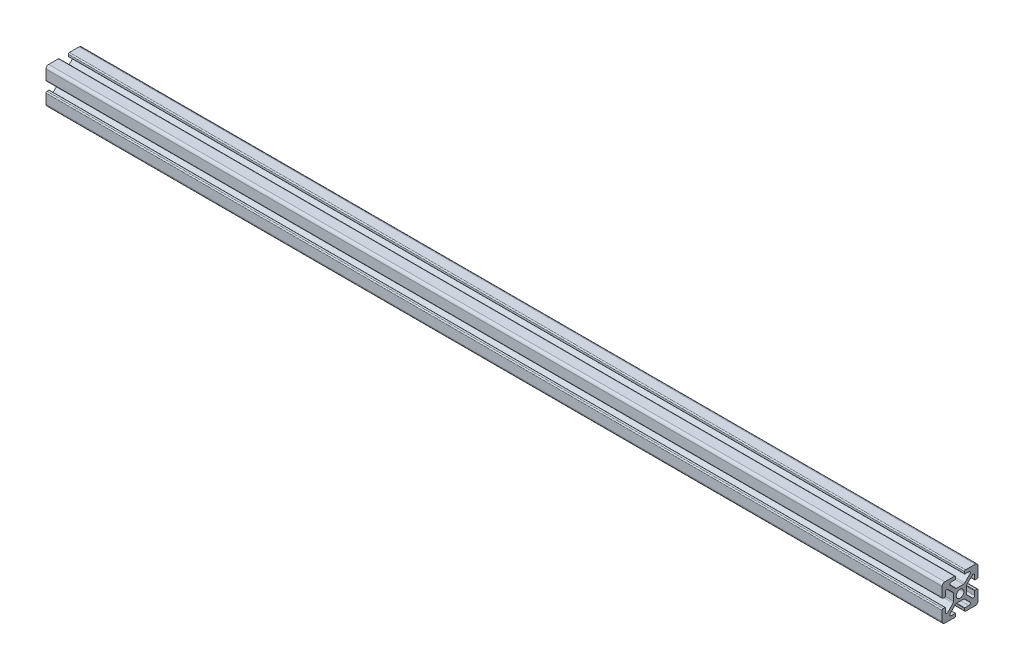
from build123d import *
from build123d.topology import SkipClean

# Parameters (mm, degrees)
BOSS_EXTRUDE1_DEPTH      = 152.4
BOSS_EXTRUDE1_DEPTH_BACK = 152.4
SKETCH4_R                = 2.15
BOSS_EXTRUDE2_DEPTH      = 195.2


with BuildPart() as part:
    # Sketch3 → Boss-Extrude1 (new, two sides: drawn at the far end of the back side and taken through both)
    with BuildSketch(Plane(origin=(0, 0, 0), x_dir=(0, 0, -1), z_dir=(1, 0, 0)).offset(-BOSS_EXTRUDE1_DEPTH_BACK)):
        with BuildLine():
            Line((-5.515685425, 6.807463915), (-2.601114729, 3.892893219))
            ThreePointArc((-2.601114729, 3.892893219), (-2.27669138, 3.676120467), (-1.894007948, 3.6))
            Line((-1.894007948, 3.6), (0, 3.6))
            Line((0, 3.6), (0, 2.15))
            ThreePointArc((0, 2.15), (-1.52027958, 1.52027958), (-2.15, 0))
            Line((-2.15, 0), (-3.6, 0))
            Line((-3.6, 0), (-3.6, 1.894007948))
            ThreePointArc((-3.6, 1.894007948), (-3.676120467, 2.27669138), (-3.892893219, 2.601114729))
            Line((-3.892893219, 2.601114729), (-6.807463915, 5.515685425))
            ThreePointArc((-6.807463915, 5.515685425), (-7.679296086, 5.689103626), (-8.17314934, 4.95))
            Line((-8.17314934, 4.95), (-8.17314934, 2.7))
            ThreePointArc((-8.17314934, 2.7), (-8.231727984, 2.558578644), (-8.37314934, 2.5))
            Line((-8.37314934, 2.5), (-9.4, 2.5))
            ThreePointArc((-9.4, 2.5), (-9.824264069, 2.675735931), (-10, 3.1))
            Line((-10, 3.1), (-10, 8.5))
            ThreePointArc((-10, 8.5), (-9.560660172, 9.560660172), (-8.5, 10))
            Line((-8.5, 10), (-3.1, 10))
            ThreePointArc((-3.1, 10), (-2.675735931, 9.824264069), (-2.5, 9.4))
            Line((-2.5, 9.4), (-2.5, 8.37314934))
            ThreePointArc((-2.5, 8.37314934), (-2.558578644, 8.231727984), (-2.7, 8.17314934))
            Line((-2.7, 8.17314934), (-4.95, 8.17314934))
            ThreePointArc((-4.95, 8.17314934), (-5.689103626, 7.679296086), (-5.515685425, 6.807463915))
        make_face()
    extrude(amount=BOSS_EXTRUDE1_DEPTH + BOSS_EXTRUDE1_DEPTH_BACK)

    # Mirror1: part across plane


with BuildPart() as part_1:
    add(part.part)
    add(part.part.mirror(Plane.ZX))

    # Mirror2: part across plane


with BuildPart() as part_2:
    add(part_1.part)
    add(part_1.part.mirror(Plane.XY))

    # Sketch4 → Boss-Extrude2 (add)
    with SkipClean():  # the faces are left unmerged after this step: merging them gives an invalid solid
        with BuildSketch(Plane(origin=(152.4, 0, 0), x_dir=(0, 0, -1), z_dir=(1, 0, 0))):
            with BuildLine():
                Line((1.894007948, 3.6), (-1.894007948, 3.6))
                ThreePointArc((-1.894007948, 3.6), (-2.27669138, 3.676120467), (-2.601114729, 3.892893219))
                Line((-2.601114729, 3.892893219), (-5.515685425, 6.807463915))
                ThreePointArc((-5.515685425, 6.807463915), (-5.689103626, 7.679296086), (-4.95, 8.17314934))
                Line((-4.95, 8.17314934), (-2.7, 8.17314934))
                ThreePointArc((-2.7, 8.17314934), (-2.558578644, 8.231727984), (-2.5, 8.37314934))
                Line((-2.5, 8.37314934), (-2.5, 9.4))
                ThreePointArc((-2.5, 9.4), (-2.675735931, 9.824264069), (-3.1, 10))
                Line((-3.1, 10), (-8.5, 10))
                ThreePointArc((-8.5, 10), (-9.560660172, 9.560660172), (-10, 8.5))
                Line((-10, 8.5), (-10, 3.1))
                ThreePointArc((-10, 3.1), (-9.824264069, 2.675735931), (-9.4, 2.5))
                Line((-9.4, 2.5), (-8.37314934, 2.5))
                ThreePointArc((-8.37314934, 2.5), (-8.231727984, 2.558578644), (-8.17314934, 2.7))
                Line((-8.17314934, 2.7), (-8.17314934, 4.95))
                ThreePointArc((-8.17314934, 4.95), (-7.679296086, 5.689103626), (-6.807463915, 5.515685425))
                Line((-6.807463915, 5.515685425), (-3.892893219, 2.601114729))
                ThreePointArc((-3.892893219, 2.601114729), (-3.676120467, 2.27669138), (-3.6, 1.894007948))
                Line((-3.6, 1.894007948), (-3.6, -1.894007948))
                ThreePointArc((-3.6, -1.894007948), (-3.676120467, -2.27669138), (-3.892893219, -2.601114729))
                Line((-3.892893219, -2.601114729), (-6.807463915, -5.515685425))
                ThreePointArc((-6.807463915, -5.515685425), (-7.679296086, -5.689103626), (-8.17314934, -4.95))
                Line((-8.17314934, -4.95), (-8.17314934, -2.7))
                ThreePointArc((-8.17314934, -2.7), (-8.231727984, -2.558578644), (-8.37314934, -2.5))
                Line((-8.37314934, -2.5), (-9.4, -2.5))
                ThreePointArc((-9.4, -2.5), (-9.824264069, -2.675735931), (-10, -3.1))
                Line((-10, -3.1), (-10, -8.5))
                ThreePointArc((-10, -8.5), (-9.560660172, -9.560660172), (-8.5, -10))
                Line((-8.5, -10), (-3.1, -10))
                ThreePointArc((-3.1, -10), (-2.675735931, -9.824264069), (-2.5, -9.4))
                Line((-2.5, -9.4), (-2.5, -8.37314934))
                ThreePointArc((-2.5, -8.37314934), (-2.558578644, -8.231727984), (-2.7, -8.17314934))
                Line((-2.7, -8.17314934), (-4.95, -8.17314934))
                ThreePointArc((-4.95, -8.17314934), (-5.689103626, -7.679296086), (-5.515685425, -6.807463915))
                Line((-5.515685425, -6.807463915), (-2.601114729, -3.892893219))
                ThreePointArc((-2.601114729, -3.892893219), (-2.27669138, -3.676120467), (-1.894007948, -3.6))
                Line((-1.894007948, -3.6), (1.894007948, -3.6))
                ThreePointArc((1.894007948, -3.6), (2.27669138, -3.676120467), (2.601114729, -3.892893219))
                Line((2.601114729, -3.892893219), (5.515685425, -6.807463915))
                ThreePointArc((5.515685425, -6.807463915), (5.689103626, -7.679296086), (4.95, -8.17314934))
                Line((4.95, -8.17314934), (2.7, -8.17314934))
                ThreePointArc((2.7, -8.17314934), (2.558578644, -8.231727984), (2.5, -8.37314934))
                Line((2.5, -8.37314934), (2.5, -9.4))
                ThreePointArc((2.5, -9.4), (2.675735931, -9.824264069), (3.1, -10))
                Line((3.1, -10), (8.5, -10))
                ThreePointArc((8.5, -10), (9.560660172, -9.560660172), (10, -8.5))
                Line((10, -8.5), (10, -3.1))
                ThreePointArc((10, -3.1), (9.824264069, -2.675735931), (9.4, -2.5))
                Line((9.4, -2.5), (8.37314934, -2.5))
                ThreePointArc((8.37314934, -2.5), (8.231727984, -2.558578644), (8.17314934, -2.7))
                Line((8.17314934, -2.7), (8.17314934, -4.95))
                ThreePointArc((8.17314934, -4.95), (7.679296086, -5.689103626), (6.807463915, -5.515685425))
                Line((6.807463915, -5.515685425), (3.892893219, -2.601114729))
                ThreePointArc((3.892893219, -2.601114729), (3.676120467, -2.27669138), (3.6, -1.894007948))
                Line((3.6, -1.894007948), (3.6, 1.894007948))
                ThreePointArc((3.6, 1.894007948), (3.676120467, 2.27669138), (3.892893219, 2.601114729))
                Line((3.892893219, 2.601114729), (6.807463915, 5.515685425))
                ThreePointArc((6.807463915, 5.515685425), (7.679296086, 5.689103626), (8.17314934, 4.95))
                Line((8.17314934, 4.95), (8.17314934, 2.7))
                ThreePointArc((8.17314934, 2.7), (8.231727984, 2.558578644), (8.37314934, 2.5))
                Line((8.37314934, 2.5), (9.4, 2.5))
                ThreePointArc((9.4, 2.5), (9.824264069, 2.675735931), (10, 3.1))
                Line((10, 3.1), (10, 8.5))
                ThreePointArc((10, 8.5), (9.560660172, 9.560660172), (8.5, 10))
                Line((8.5, 10), (3.1, 10))
                ThreePointArc((3.1, 10), (2.675735931, 9.824264069), (2.5, 9.4))
                Line((2.5, 9.4), (2.5, 8.37314934))
                ThreePointArc((2.5, 8.37314934), (2.558578644, 8.231727984), (2.7, 8.17314934))
                Line((2.7, 8.17314934), (4.95, 8.17314934))
                ThreePointArc((4.95, 8.17314934), (5.689103626, 7.679296086), (5.515685425, 6.807463915))
                Line((5.515685425, 6.807463915), (2.601114729, 3.892893219))
                ThreePointArc((2.601114729, 3.892893219), (2.27669138, 3.676120467), (1.894007948, 3.6))
            make_face()
            Circle(SKETCH4_R, mode=Mode.SUBTRACT)
        extrude(amount=BOSS_EXTRUDE2_DEPTH)


solid = part_2.part
